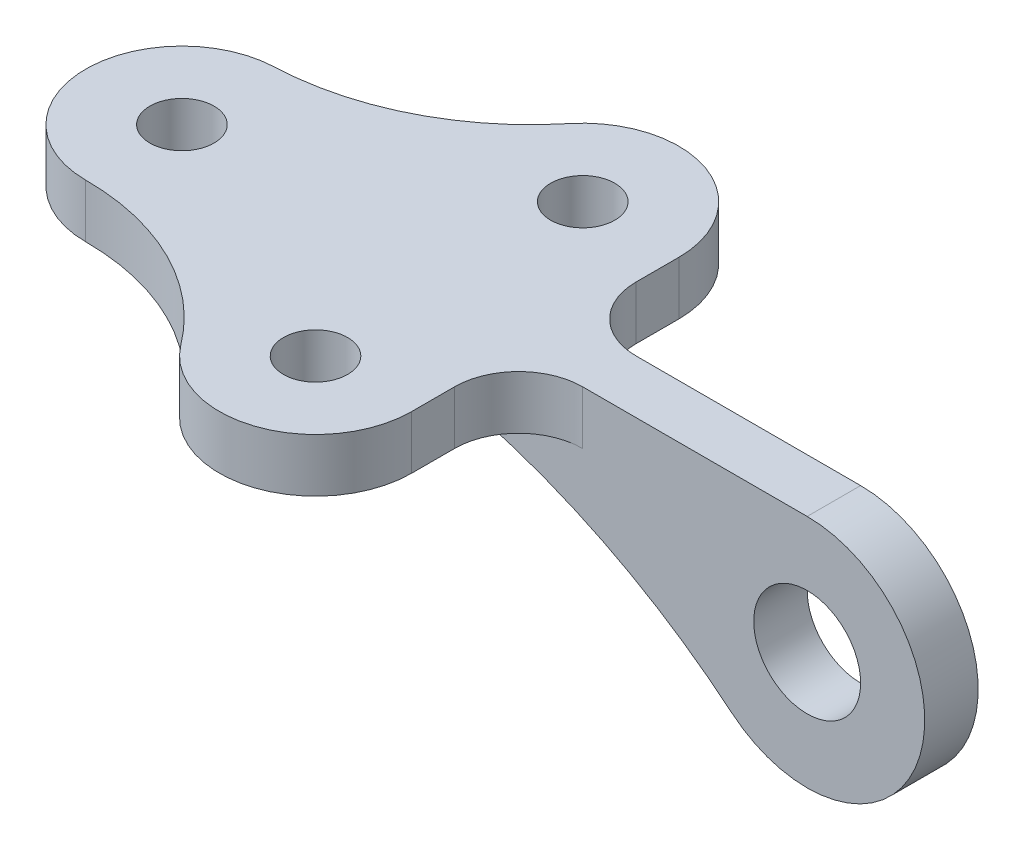
from build123d import *

# Parameters (mm, degrees)
SKETCH2_R           = 6
BOSS_EXTRUDE1_DEPTH = 5
SKETCH3_R           = 10
BOSS_EXTRUDE2_DEPTH = 5
FILLET1_R           = 12


with BuildPart() as part:
    # Sketch2 → Boss-Extrude1 (new, symmetric)
    with BuildSketch(Plane(origin=(0, 0, 0), x_dir=(1, 0, 0), z_dir=(0, 1, 0))):
        with BuildLine():
            Line((68, -25), (68, 25))
            ThreePointArc((68, 25), (56.032896381, 41.958896227), (36.043982083, 36.367918187))
            ThreePointArc((36.043982083, 36.367918187), (19.637945422, 23.224109156), (-0.720723799, 17.985565246))
            ThreePointArc((-0.720723799, 17.985565246), (-17.99639095, -0.360434168), (0, -18))
            ThreePointArc((0, -18), (19.901005, -22.697990001), (35.6, -35.8))
            ThreePointArc((35.6, -35.8), (55.692099788, -42.076299365), (68, -25))
        make_face()
        with Locations(Location((0, 0, 0), (0, 0, 270))):
            Circle(SKETCH2_R, mode=Mode.SUBTRACT)
        with Locations(Location((50, -25, 0), (0, 0, 270))):
            Circle(SKETCH2_R, mode=Mode.SUBTRACT)
        with Locations(Location((50, 25, 0), (0, 0, 270))):
            Circle(SKETCH2_R, mode=Mode.SUBTRACT)
    extrude(amount=BOSS_EXTRUDE1_DEPTH, both=True)

    # Sketch3 → Boss-Extrude2 (add, symmetric)
    with BuildSketch(Plane.XY):
        with BuildLine():
            Line((12, 5), (122, 5))
            ThreePointArc((122, 5), (142.688818499, -24.481496449), (107.928788897, -33.911564626))
            ThreePointArc((107.928788897, -33.911564626), (70.487228363, -12.449894892), (27.978725812, -5))
            Line((27.978725812, -5), (12, -5))
            Line((12, -5), (12, 5))
        make_face()
        with Locations((122, -17)):
            Circle(SKETCH3_R, mode=Mode.SUBTRACT)
    extrude(amount=BOSS_EXTRUDE2_DEPTH, both=True)

    # Fillet1
    fillet1_edges = [part.edges().sort_by_distance(p)[0] for p in [
        (68, 0, 5),
        (68, 0, -5),
    ]]
    fillet(fillet1_edges, radius=FILLET1_R)


solid = part.part
